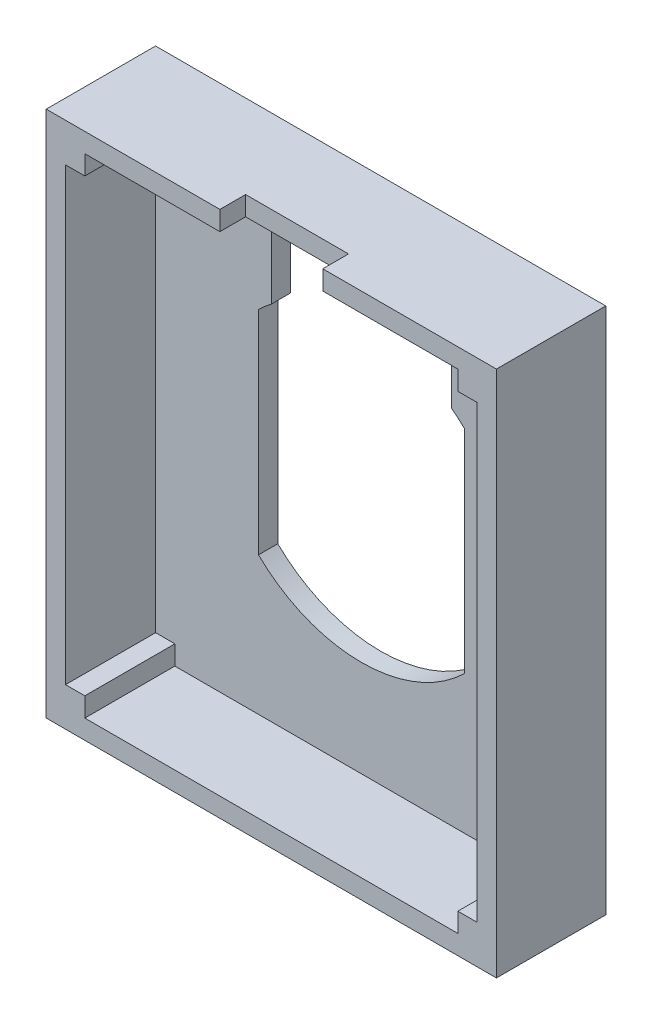
from build123d import *

# Parameters (mm, degrees)
SKETCH_1_W          = 35
SKETCH_1_H          = 41
EXTRUDE_1_DEPTH     = 1.5
EXTRUDE_2_DEPTH     = 7
SKETCH_3_W          = 8
SKETCH_3_H          = 1.5
CUT_EXTRUDE_1_DEPTH = 2


with BuildPart() as part:
    # Эскиз1 → Бобышка-Вытянуть1 (new body)
    with BuildSketch(Plane.XY):
        Rectangle(SKETCH_1_W, SKETCH_1_H)
        with BuildLine():
            Line((7, 9.124143795), (7, 15))
            Line((7, 15), (-7, 15))
            Line((-7, 15), (-7, 9.124143795))
            ThreePointArc((-7, 9.124143795), (-7.512396473, 8.707117734), (-8, 8.261355821))
            Line((-8, 8.261355821), (-8, -8.261355821))
            ThreePointArc((-8, -8.261355821), (0, -11.5), (8, -8.261355821))
            Line((8, -8.261355821), (8, 8.261355821))
            ThreePointArc((8, 8.261355821), (7.512396473, 8.707117734), (7, 9.124143795))
        make_face(mode=Mode.SUBTRACT)
    extrude(amount=EXTRUDE_1_DEPTH)

    # Эскиз2 → Бобышка-Вытянуть2 (add)
    with BuildSketch(Plane.XY.offset(1.5)):
        Polygon((-17.5, -20.5), (17.5, -20.5), (17.5, 20.5), (-14.5, 20.5), (-17.5, 20.5), (-17.5, 17.5), align=None)
        Polygon((14.5, -17.5), (14.5, -19), (-14.5, -19), (-14.5, -17.5), (-16, -17.5), (-16, 17.5), (-14.5, 17.5), (-14.5, 19), (14.5, 19), (14.5, 17.5), (16, 17.5), (16, -17.5), align=None, mode=Mode.SUBTRACT)
    extrude(amount=EXTRUDE_2_DEPTH)

    # Эскиз3 → Вырез-Вытянуть1 (cut)
    with BuildSketch(Plane.XY.offset(8.5)):
        with Locations((0, 19.75)):
            Rectangle(SKETCH_3_W, SKETCH_3_H)
    extrude(amount=-CUT_EXTRUDE_1_DEPTH, mode=Mode.SUBTRACT)


solid = part.part
